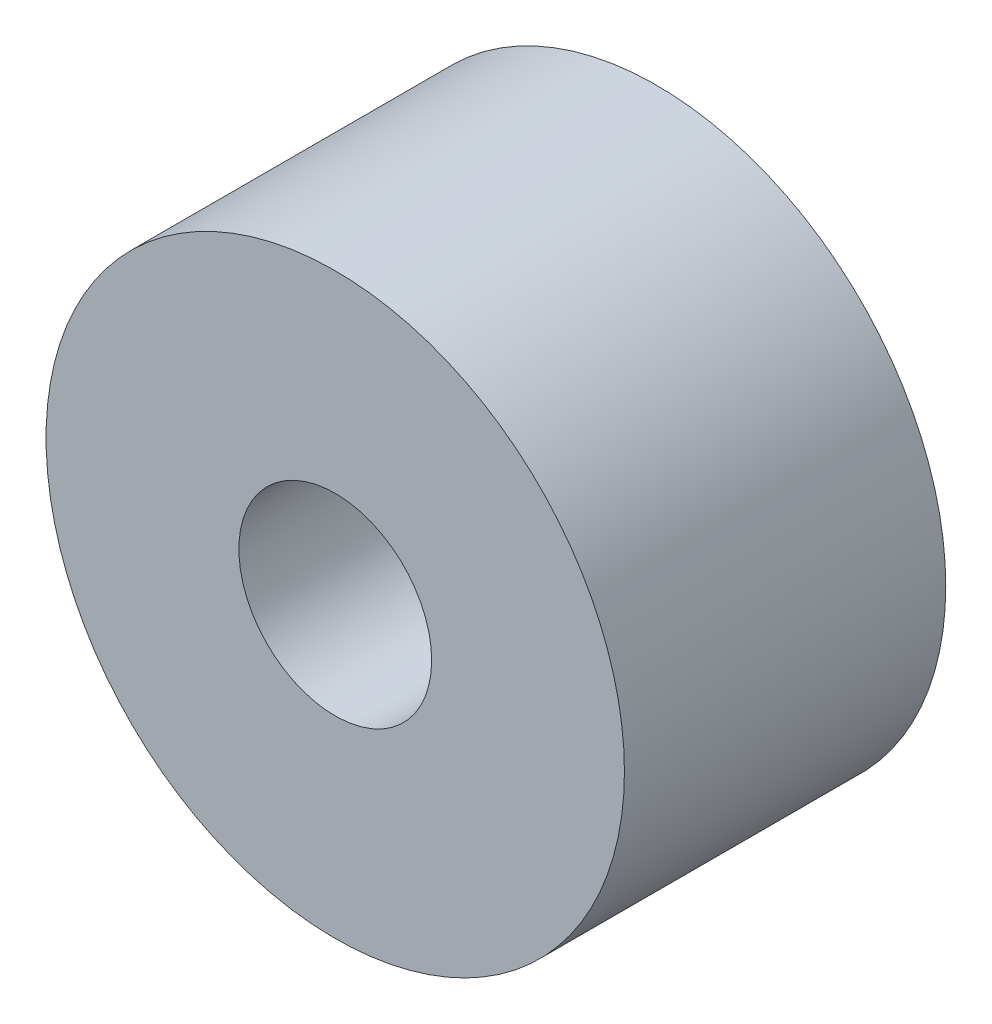
from build123d import *

# Parameters (mm, degrees)
SKETCH_1_R      = 4.5
SKETCH_1_R_2    = 1.5
EXTRUDE_1_DEPTH = 5


with BuildPart() as part:
    # 草图1 → 凸台-拉伸1 (new body)
    with BuildSketch(Plane.XY):
        Circle(SKETCH_1_R)
        Circle(SKETCH_1_R_2, mode=Mode.SUBTRACT)
    extrude(amount=EXTRUDE_1_DEPTH)


solid = part.part
